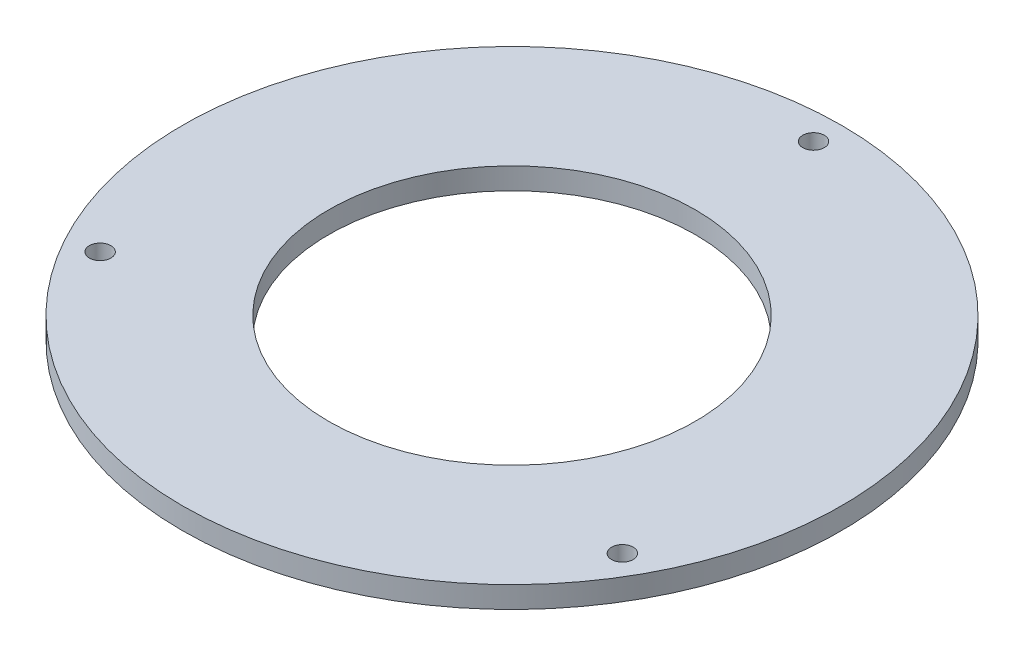
from build123d import *

# Parameters (mm, degrees)
SKETCH1_R           = 97.028
BOSS_EXTRUDE1_DEPTH = 6.35
SKETCH2_R           = 3.175
CUT_EXTRUDE1_DEPTH  = 138.365163226
SKETCH3_R           = 53.975
CUT_EXTRUDE2_DEPTH  = 138.365163226


with BuildPart() as part:
    # Sketch1 → Boss-Extrude1 (new body)
    with BuildSketch(Plane(origin=(0, 0, 0), x_dir=(1, 0, 0), z_dir=(0, 1, 0))):
        with Locations(Location((0, 0, 0), (0, 0, 270))):
            Circle(SKETCH1_R)
    extrude(amount=BOSS_EXTRUDE1_DEPTH)

    # Sketch2 → Cut-Extrude1 (cut, through all)
    with BuildSketch(Plane(origin=(0, 6.35, 0), x_dir=(1, 0, 0), z_dir=(0, 1, 0))):
        with Locations(Location((0, 88.773, 0), (0, 0, 270))):
            Circle(SKETCH2_R)
        with Locations(Location((76.87967317, -44.3865, 0), (0, 0, 270))):
            Circle(SKETCH2_R)
        with Locations(Location((-76.87967317, -44.3865, 0), (0, 0, 270))):
            Circle(SKETCH2_R)
    extrude(amount=-CUT_EXTRUDE1_DEPTH, mode=Mode.SUBTRACT)

    # Sketch3 → Cut-Extrude2 (cut, through all)
    with BuildSketch(Plane(origin=(0, 6.35, 0), x_dir=(1, 0, 0), z_dir=(0, 1, 0))):
        with Locations(Location((0, 0, 0), (0, 0, 270))):
            Circle(SKETCH3_R)
    extrude(amount=-CUT_EXTRUDE2_DEPTH, mode=Mode.SUBTRACT)


solid = part.part
